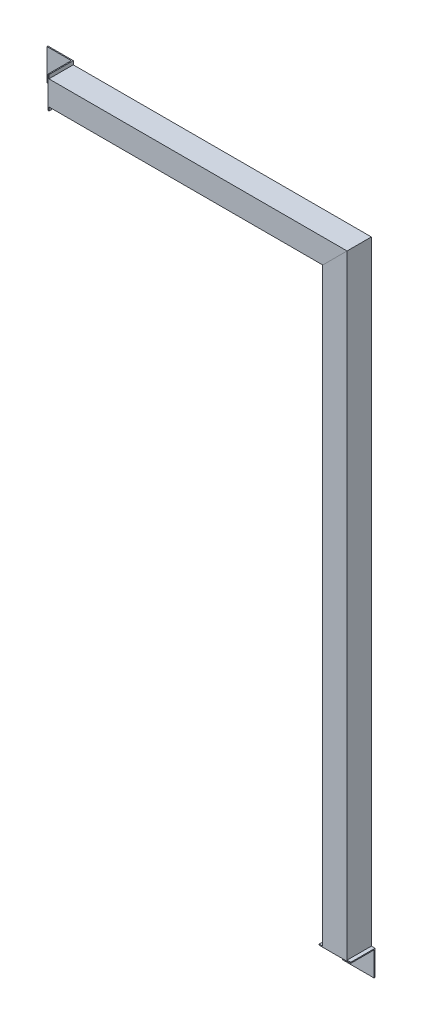
from build123d import *

# Parameters (mm, degrees)
SKETCH2_W           = 50
SKETCH2_H           = 50
SKETCH2_W_2         = 46
SKETCH2_H_2         = 46
SKETCH3_W           = 65
SKETCH3_H           = 50
BOSS_EXTRUDE1_DEPTH = 2
SKETCH4_W           = 50
SKETCH4_H           = 65
BOSS_EXTRUDE2_DEPTH = 2
SKETCH5_W           = 2
SKETCH5_H           = 65
SKETCH5_W_2         = 65
SKETCH5_H_2         = 2
BOSS_EXTRUDE3_DEPTH = 50
SKETCH6_W           = 65
SKETCH6_H           = 50
SKETCH6_W_2         = 50
SKETCH6_H_2         = 65
BOSS_EXTRUDE4_DEPTH = 48
SKETCH7_W           = 50
SKETCH7_H           = 65
SKETCH7_W_2         = 65
SKETCH7_H_2         = 50
CUT_EXTRUDE1_DEPTH  = 48


with BuildPart() as part:
    # Sweep1: sweep along a path in Sketch1
    with BuildLine(Plane.XY) as sweep1_path:
        Line((-615, 1265), (0, 1265))
        Line((0, 1265), (0, 0))
    # Sketch2 → Sweep1 (sweep)
    with BuildSketch(Plane(origin=(0, 0, 0), x_dir=(1, 0, 0), z_dir=(0, 1, 0))):
        with Locations((-25, 0)):
            Rectangle(SKETCH2_W, SKETCH2_H)
        with Locations((-25, 0)):
            Rectangle(SKETCH2_W_2, SKETCH2_H_2, mode=Mode.SUBTRACT)
    sweep(path=sweep1_path.line, transition=Transition.RIGHT)

    # Sketch3 → Boss-Extrude1 (add)
    with BuildSketch(Plane.XY.offset(25)):
        with Locations((-25, -25)):
            Rectangle(SKETCH3_W, SKETCH3_H)
    extrude(amount=-BOSS_EXTRUDE1_DEPTH)

    # Sketch4 → Boss-Extrude2 (add)
    with BuildSketch(Plane.XY.offset(25)):
        with Locations((-640, 1240)):
            Rectangle(SKETCH4_W, SKETCH4_H)
    extrude(amount=-BOSS_EXTRUDE2_DEPTH)

    # Sketch5 → Boss-Extrude3 (add)
    with BuildSketch(Plane.XY.offset(25)):
        with Locations((-614, 1240)):
            Rectangle(SKETCH5_W, SKETCH5_H)
        with Locations((-25, 1)):
            Rectangle(SKETCH5_W_2, SKETCH5_H_2)
    extrude(amount=-BOSS_EXTRUDE3_DEPTH)

    # Sketch6 → Boss-Extrude4 (add)
    with BuildSketch(Plane(origin=(0, 0, 23), x_dir=(-1, 0, 0), z_dir=(0, 0, -1))):
        with Locations((25, -25)):
            Rectangle(SKETCH6_W, SKETCH6_H)
        with Locations((640, 1240)):
            Rectangle(SKETCH6_W_2, SKETCH6_H_2)
    extrude(amount=BOSS_EXTRUDE4_DEPTH)

    # Sketch7 → Cut-Extrude1 (cut)
    with BuildSketch(Plane.XY.offset(25)):
        with Locations((-640, 1240)):
            Rectangle(SKETCH7_W, SKETCH7_H)
        with Locations((-25, -25)):
            Rectangle(SKETCH7_W_2, SKETCH7_H_2)
    extrude(amount=-CUT_EXTRUDE1_DEPTH, mode=Mode.SUBTRACT)


solid = part.part
